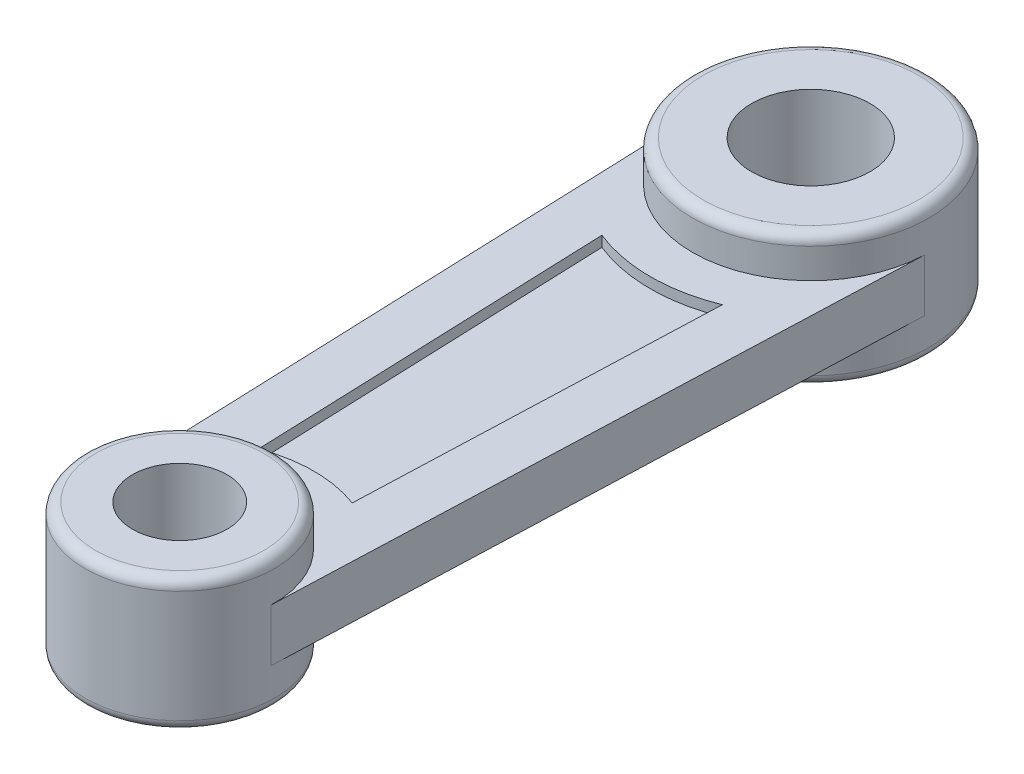
from build123d import *

# Parameters (mm, degrees)
SKETCH1_R             = 45
SKETCH1_R_2           = 22.5
BOSS_EXTRUDE1_DEPTH   = 31.65
SKETCH1_R_3           = 56.25
SKETCH1_R_4           = 28.15
BOSS_EXTRUDE1_2_DEPTH = 31.65
BOSS_EXTRUDE2_DEPTH   = 12.5
CUT_EXTRUDE1_DEPTH    = 5
CUT_EXTRUDE2_START    = -5
CUT_EXTRUDE2_DEPTH    = 5
FILLET1_R             = 5


with BuildPart() as part:
    # Sketch1 → Boss-Extrude1 (new, symmetric)
    with BuildSketch(Plane(origin=(0, 0, 0), x_dir=(1, 0, 0), z_dir=(0, 1, 0))):
        with Locations(Location((0, 0, 0), (0, 0, 270))):
            Circle(SKETCH1_R)
        with Locations(Location((0, 0, 0), (0, 0, 270))):
            Circle(SKETCH1_R_2, mode=Mode.SUBTRACT)
    extrude(amount=BOSS_EXTRUDE1_DEPTH, both=True)



with BuildPart() as body_2:
    # Sketch1 → Boss-Extrude1 2 (new, symmetric)
    with BuildSketch(Plane(origin=(0, 0, 0), x_dir=(1, 0, 0), z_dir=(0, 1, 0))):
        with Locations(Location((0, 300, 0), (0, 0, 270))):
            Circle(SKETCH1_R_3)
        with Locations(Location((0, 300, 0), (0, 0, 270))):
            Circle(SKETCH1_R_4, mode=Mode.SUBTRACT)
    extrude(amount=BOSS_EXTRUDE1_2_DEPTH, both=True)


with BuildPart() as part_1:
    add(part.part)

    add(body_2.part)  # Boss-Extrude2 merges body 2
    # Sketch2 → Boss-Extrude2 (add, symmetric)
    with BuildSketch(Plane(origin=(0, 0, 0), x_dir=(1, 0, 0), z_dir=(0, 1, 0))):
        with BuildLine():
            Line((-56.210435304, 297.890625), (-44.968348244, -1.6875))
            ThreePointArc((-44.968348244, -1.6875), (0, 45), (44.968348244, -1.6875))
            Line((44.968348244, -1.6875), (56.210435304, 297.890625))
            ThreePointArc((56.210435304, 297.890625), (0, 243.75), (-56.210435304, 297.890625))
        make_face()
    extrude(amount=BOSS_EXTRUDE2_DEPTH, both=True)

    # Sketch3 → Cut-Extrude1 (cut)
    with BuildSketch(Plane(origin=(0, 12.5, 0), x_dir=(1, 0, 0), z_dir=(0, 1, 0))):
        with BuildLine():
            Line((-28.619814412, 229.324907336), (-22.255863805, 59.73892388))
            ThreePointArc((-22.255863805, 59.73892388), (0, 63.75), (22.255863805, 59.73892388))
            Line((22.255863805, 59.73892388), (28.619814412, 229.324907336))
            ThreePointArc((28.619814412, 229.324907336), (0, 223.75), (-28.619814412, 229.324907336))
        make_face()
    extrude(amount=-CUT_EXTRUDE1_DEPTH, mode=Mode.SUBTRACT)

    # Sketch4 → Cut-Extrude2 (cut)
    with BuildSketch(Plane.XZ.offset(12.5).offset(CUT_EXTRUDE2_START)):
        with BuildLine():
            Line((22.255863805, -59.73892388), (28.619814412, -229.324907336))
            ThreePointArc((28.619814412, -229.324907336), (0, -223.75), (-28.619814412, -229.324907336))
            Line((-28.619814412, -229.324907336), (-22.255863805, -59.73892388))
            ThreePointArc((-22.255863805, -59.73892388), (0, -63.75), (22.255863805, -59.73892388))
        make_face()
    extrude(amount=CUT_EXTRUDE2_DEPTH, mode=Mode.SUBTRACT)

    # Fillet1
    fillet1_edges = [part_1.edges().sort_by_distance(p)[0] for p in [
        (0, -31.65, -45),
        (0, 31.65, -356.25),
        (0, -31.65, -356.25),
        (0, 31.65, -45),
    ]]
    fillet(fillet1_edges, radius=FILLET1_R)


solid = part_1.part
